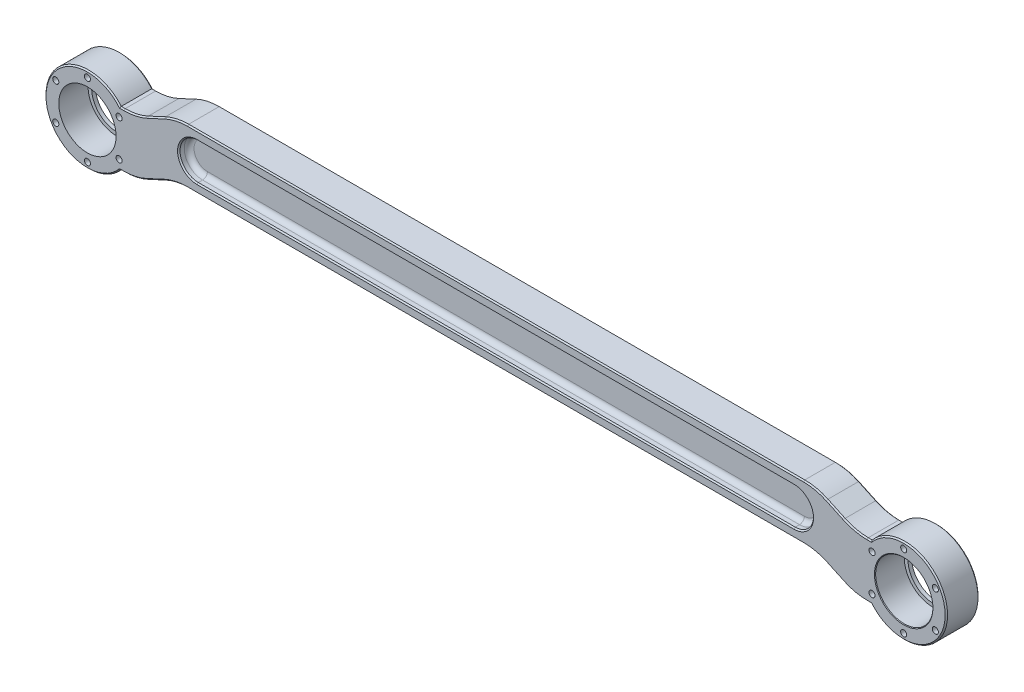
from build123d import *

# Parameters (mm, degrees)
EXTRUDE_1_DEPTH      = 27
SKETCH_2_R           = 20.5
CUT_EXTRUDE_1_DEPTH  = 45
CUT_EXTRUDE_2_DEPTH  = 50
EXTRUDE_2_DEPTH      = 27
CUT_EXTRUDE_3_DEPTH  = 8.5
CUT_EXTRUDE_START    = -8.5
CUT_EXTRUDE_4_DEPTH  = 8.5
CHAMFER_2_SIZE       = 1
FILLET_1_R           = 4
FILLET_2_R           = 45
EXTRUDE_START        = -27
EXTRUDE_3_DEPTH      = 27
SKETCH_13_R          = 23.5
CUT_EXTRUDE_8_DEPTH  = 24
SKETCH_14_R          = 2.5
CUT_EXTRUDE_9_DEPTH  = 20
CHAMFER_3_SIZE       = 0.5
CHAMFER_4_SIZE       = 1
SKETCH_15_R          = 4
CUT_EXTRUDE_10_DEPTH = 20
SKETCH_16_R          = 4
CUT_EXTRUDE_11_DEPTH = 20


with BuildPart() as part:
    # 草图1 → 拉伸1 (new body)
    with BuildSketch(Plane.XY):
        with BuildLine():
            Line((0, 22.5), (670, 22.5))
            ThreePointArc((670, 22.5), (692.5, 0), (670, -22.5))
            Line((670, -22.5), (0, -22.5))
            ThreePointArc((0, -22.5), (-22.5, 0), (0, 22.5))
        make_face()
    extrude(amount=EXTRUDE_1_DEPTH)

    # 草图2 → 切除-拉伸1 (cut)
    with BuildSketch(Plane.XY.offset(27)):
        Circle(SKETCH_2_R)
        with Locations((670, 0)):
            Circle(SKETCH_2_R)
    extrude(amount=-CUT_EXTRUDE_1_DEPTH, mode=Mode.SUBTRACT)

    # 草图3 → 切除-拉伸2 (cut)
    with BuildSketch(Plane.XY.offset(27)):
        Polygon((40, -22.5), (72.167603808, -7.5), (597.832396192, -7.5), (630, -22.5), align=None)
    extrude(amount=-CUT_EXTRUDE_2_DEPTH, mode=Mode.SUBTRACT)

    # 草图4 → 拉伸2 (add)
    with BuildSketch(Plane.XY.offset(27)):
        Polygon((630, 22.5), (40, 22.5), (72.167603808, 37.5), (597.832396192, 37.5), align=None)
    extrude(amount=-EXTRUDE_2_DEPTH)

    # 草图5 → 切除-拉伸3 (cut)
    with BuildSketch(Plane.XY.offset(27)):
        with BuildLine():
            Line((90, 30), (580, 30))
            ThreePointArc((580, 30), (595, 15), (580, 0))
            Line((580, 0), (90, 0))
            ThreePointArc((90, 0), (75, 15), (90, 30))
        make_face()
    extrude(amount=-CUT_EXTRUDE_3_DEPTH, mode=Mode.SUBTRACT)

    # 草图7 → 切除-拉伸4 (cut)
    with BuildSketch(Plane(origin=(0, 0, 0), x_dir=(-1, 0, 0), z_dir=(0, 0, -1)).offset(CUT_EXTRUDE_START)):
        with BuildLine():
            Line((-90, 30), (-580, 30))
            ThreePointArc((-580, 30), (-595, 15), (-580, 0))
            Line((-580, 0), (-90, 0))
            ThreePointArc((-90, 0), (-75, 15), (-90, 30))
        make_face()
    extrude(amount=CUT_EXTRUDE_4_DEPTH, mode=Mode.SUBTRACT)

    # 倒角2
    chamfer_2_edges = [part.edges().sort_by_distance(p)[0] for p in [
        (75, 15, 27),
        (335, 0, 27),
        (595, 15, 27),
        (335, 30, 27),
        (75, 15, 0),
        (335, 30, 0),
        (595, 15, 0),
        (335, 0, 0),
    ]]
    chamfer(chamfer_2_edges, length=CHAMFER_2_SIZE)

    # 圆角1
    fillet_1_edges = [part.edges().sort_by_distance(p)[0] for p in [
        (75, 15, 18.5),
        (335, 30, 18.5),
        (595, 15, 18.5),
        (335, 0, 18.5),
        (75, 15, 8.5),
        (335, 0, 8.5),
        (595, 15, 8.5),
        (335, 30, 8.5),
    ]]
    fillet(fillet_1_edges, radius=FILLET_1_R)

    # 圆角2
    fillet_2_edges = [part.edges().sort_by_distance(p)[0] for p in [
        (630, -22.5, 13.5),
        (40, -22.5, 13.5),
        (72.167603808, -7.5, 13.5),
        (597.832396192, -7.5, 13.5),
        (597.832396192, 37.5, 13.5),
        (630, 22.5, 13.5),
        (40, 22.5, 13.5),
        (72.167603808, 37.5, 13.5),
    ]]
    fillet(fillet_2_edges, radius=FILLET_2_R)

    # 草图8 → 拉伸3 (add)
    with BuildSketch(Plane.XY.offset(27).offset(EXTRUDE_START)):
        with BuildLine():
            Line((0, 22.5), (26.809513237, 22.5))
            ThreePointArc((26.809513237, 22.5), (-35, 0), (26.809513237, -22.5))
            Line((26.809513237, -22.5), (0, -22.5))
            ThreePointArc((0, -22.5), (-22.5, 0), (0, 22.5))
        make_face()
        with BuildLine():
            Line((670, 22.5), (643.190486763, 22.5))
            ThreePointArc((643.190486763, 22.5), (705, 0), (643.190486763, -22.5))
            Line((643.190486763, -22.5), (670, -22.5))
            ThreePointArc((670, -22.5), (692.5, 0), (670, 22.5))
        make_face()
    extrude(amount=EXTRUDE_3_DEPTH)

    # 草图13 → 切除-拉伸8 (cut)
    with BuildSketch(Plane.XY.offset(27)):
        Circle(SKETCH_13_R)
        with Locations((670, 0)):
            Circle(SKETCH_13_R)
    extrude(amount=-CUT_EXTRUDE_8_DEPTH, mode=Mode.SUBTRACT)

    # 草图14 → 切除-拉伸9 (cut)
    with BuildSketch(Plane.XY.offset(27)):
        with Locations((-25.980762114, -15)):
            Circle(SKETCH_14_R)
        with Locations((644.019237886, -15)):
            Circle(SKETCH_14_R)
        with Locations((670, -30)):
            Circle(SKETCH_14_R)
        with Locations((644.019237886, 15)):
            Circle(SKETCH_14_R)
        with Locations((670, 30)):
            Circle(SKETCH_14_R)
        with Locations((-25.980762114, 15)):
            Circle(SKETCH_14_R)
        with Locations((0, 30)):
            Circle(SKETCH_14_R)
        with Locations((0, -30)):
            Circle(SKETCH_14_R)
        with Locations((25.980762114, 15)):
            Circle(SKETCH_14_R)
        with Locations((25.980762114, -15)):
            Circle(SKETCH_14_R)
        with Locations((695.980762114, 15)):
            Circle(SKETCH_14_R)
        with Locations((695.980762114, -15)):
            Circle(SKETCH_14_R)
    extrude(amount=-CUT_EXTRUDE_9_DEPTH, mode=Mode.SUBTRACT)

    # 倒角3
    chamfer_3_edges = [part.edges().sort_by_distance(p)[0] for p in [
        (646.5, 0, 27),
    ]]
    chamfer(chamfer_3_edges, length=CHAMFER_3_SIZE)

    # 倒角4
    chamfer_4_edges = [part.edges().sort_by_distance(p)[0] for p in [
        (335, -7.5, 27),
        (335, -7.5, 0),
        (613.916198096, -15, 27),
        (613.916198096, -15, 0),
        (56.083801904, -15, 27),
        (641.583373291, -22.5, 27),
        (613.916198096, 30, 27),
        (335, 37.5, 27),
        (56.083801904, 30, 27),
        (28.416626709, 22.5, 27),
        (72.404080999, 36.43332032, 27),
        (39.763522808, -21.43332032, 27),
        (597.595919001, 36.43332032, 27),
        (630.236477192, -21.43332032, 27),
        (641.583373291, -22.5, 0),
        (56.083801904, -15, 0),
        (28.416626709, 22.5, 0),
        (56.083801904, 30, 0),
        (335, 37.5, 0),
        (613.916198096, 30, 0),
        (72.404080999, 36.43332032, 0),
        (39.763522808, -21.43332032, 0),
        (597.595919001, 36.43332032, 0),
        (630.236477192, -21.43332032, 0),
        (597.595919001, -8.56667968, 27),
        (597.595919001, -8.56667968, 0),
        (630.236477192, 23.56667968, 27),
        (630.236477192, 23.56667968, 0),
        (39.763522808, 23.56667968, 27),
        (39.763522808, 23.56667968, 0),
        (72.404080999, -8.56667968, 27),
        (72.404080999, -8.56667968, 0),
        (28.416626709, -22.5, 0),
        (28.416626709, -22.5, 27),
        (-35, 0, 0),
        (-35, 0, 27),
        (641.583373291, 22.5, 0),
        (641.583373291, 22.5, 27),
        (705, 0, 0),
        (705, 0, 27),
    ]]
    chamfer(chamfer_4_edges, length=CHAMFER_4_SIZE)

    # 草图15 → 切除-拉伸10 (cut)
    with BuildSketch(Plane.XZ.offset(7.5)):
        with Locations((320, 13.5)):
            Circle(SKETCH_15_R)
        with Locations((360, 13.5)):
            Circle(SKETCH_15_R)
    extrude(amount=-CUT_EXTRUDE_10_DEPTH, mode=Mode.SUBTRACT)

    # 草图16 → 切除-拉伸11 (cut)
    with BuildSketch(Plane(origin=(0, 0, 0), x_dir=(-1, 0, 0), z_dir=(0, 0, -1))):
        with Locations((-54.94315244, -2.5)):
            Circle(SKETCH_16_R)
        with Locations((-55, 17.499919209)):
            Circle(SKETCH_16_R)
    extrude(amount=-CUT_EXTRUDE_11_DEPTH, mode=Mode.SUBTRACT)


solid = part.part
